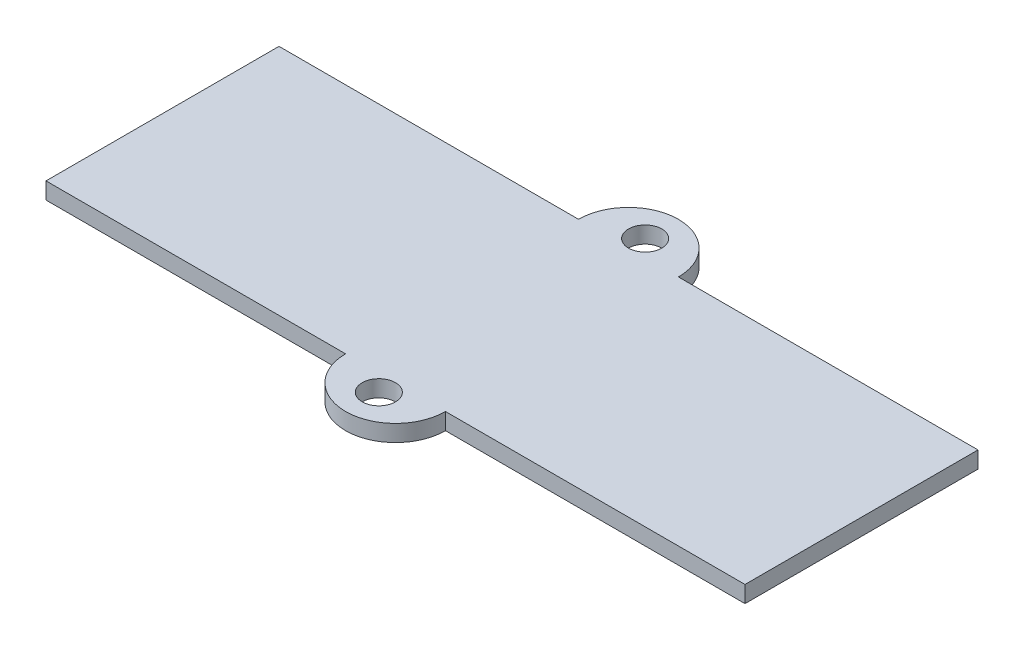
from build123d import *

# Parameters (mm, degrees)
SKETCH1_R           = 2
BOSS_EXTRUDE1_DEPTH = 2


with BuildPart() as part:
    # Sketch1 → Boss-Extrude1 (new body)
    with BuildSketch(Plane(origin=(0, 0, 0), x_dir=(1, 0, 0), z_dir=(0, 1, 0))):
        with BuildLine():
            Line((165.082783055, -24.990305924), (165.082783055, 3.009694076))
            Line((165.082783055, 3.009694076), (129.082783055, 3.009694076))
            ThreePointArc((129.082783055, 3.009694076), (123.082783055, 9.009694076), (117.082783055, 3.009694076))
            Line((117.082783055, 3.009694076), (81.082783055, 3.009694076))
            Line((81.082783055, 3.009694076), (81.082783055, -24.990305924))
            Line((81.082783055, -24.990305924), (117.082783055, -24.990305924))
            ThreePointArc((117.082783055, -24.990305924), (123.082783055, -30.990305924), (129.082783055, -24.990305924))
            Line((129.082783055, -24.990305924), (165.082783055, -24.990305924))
        make_face()
        with Locations(Location((123.082783055, 5.009694076, 0), (0, 0, 270))):
            Circle(SKETCH1_R, mode=Mode.SUBTRACT)
        with Locations(Location((123.082783055, -26.990305924, 0), (0, 0, 270))):
            Circle(SKETCH1_R, mode=Mode.SUBTRACT)
    extrude(amount=BOSS_EXTRUDE1_DEPTH)


solid = part.part
